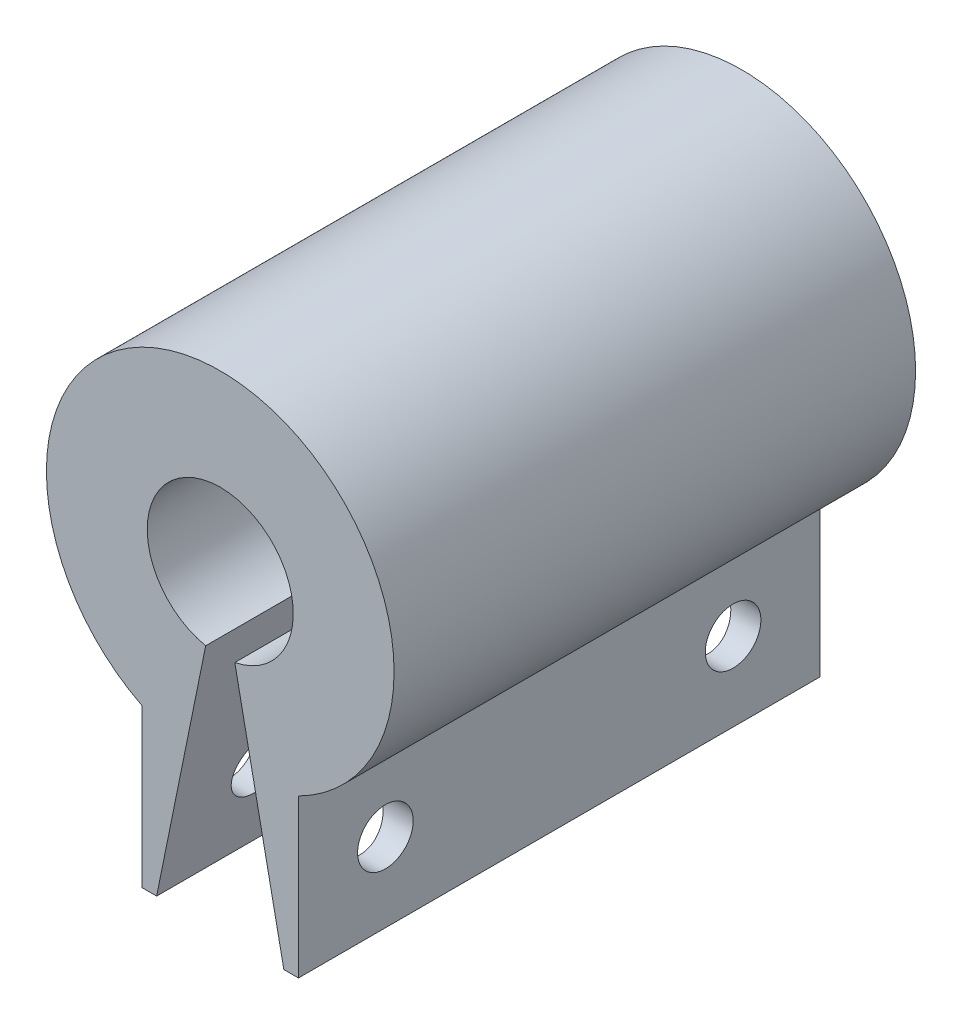
from build123d import *

# Parameters (mm, degrees)
EXTRUDE_1_DEPTH     = 30
SKETCH_2_R          = 4.2
CUT_EXTRUDE_1_DEPTH = 15
SKETCH_3_R          = 1.175
CUT_EXTRUDE_2_DEPTH = 15
SKETCH_10_R         = 1.6
CUT_EXTRUDE_8_DEPTH = 38.871493237
CUT_EXTRUDE_9_DEPTH = 37.386810797


with BuildPart() as part:
    # ｽｹｯﾁ1 → ﾎﾞｽ - 押し出し1 (new body)
    with BuildSketch(Plane.XY):
        with BuildLine():
            Line((-4.5, -8.93028555), (-4.5, -18))
            Line((-4.5, -18), (4.5, -18))
            Line((4.5, -18), (4.5, -8.93028555))
            ThreePointArc((4.5, -8.93028555), (0, 10), (-4.5, -8.93028555))
        make_face()
    extrude(amount=EXTRUDE_1_DEPTH)

    # ｽｹｯﾁ2 → ｶｯﾄ - 押し出し1 (cut)
    with BuildSketch(Plane.XY.offset(30)):
        Circle(SKETCH_2_R)
    extrude(amount=-CUT_EXTRUDE_1_DEPTH, mode=Mode.SUBTRACT)

    # ｽｹｯﾁ3 → ｶｯﾄ - 押し出し2 (cut)
    with BuildSketch(Plane(origin=(0, 0, 0), x_dir=(-1, 0, 0), z_dir=(0, 0, -1))):
        Circle(SKETCH_3_R)
    extrude(amount=-CUT_EXTRUDE_2_DEPTH, mode=Mode.SUBTRACT)

    # ｽｹｯﾁ10 → ｶｯﾄ - 押し出し8 (cut, through all)
    with BuildSketch(Plane(origin=(4.5, 0, 0), x_dir=(0, 0, -1), z_dir=(1, 0, 0))):
        with Locations(Location((-25, -13.465142775, 0), (0, 0, 90))):
            Circle(SKETCH_10_R)
        with Locations(Location((-5, -13.465142775, 0), (0, 0, 90))):
            Circle(SKETCH_10_R)
    extrude(amount=-CUT_EXTRUDE_8_DEPTH, mode=Mode.SUBTRACT)

    # ｽｹｯﾁ4 → ｶｯﾄ - 押し出し9 (cut, through all)
    with BuildSketch(Plane.XY.offset(30)):
        with BuildLine():
            Line((-0.234043532, -1.151455003), (-3.658661061, -18))
            ThreePointArc((-3.658661061, -18), (0, -18.368064698), (3.658661061, -18))
            Line((3.658661061, -18), (0.234043532, -1.151455003))
            ThreePointArc((0.234043532, -1.151455003), (0, -1.175), (-0.234043532, -1.151455003))
        make_face()
    extrude(amount=-CUT_EXTRUDE_9_DEPTH, mode=Mode.SUBTRACT)


solid = part.part
